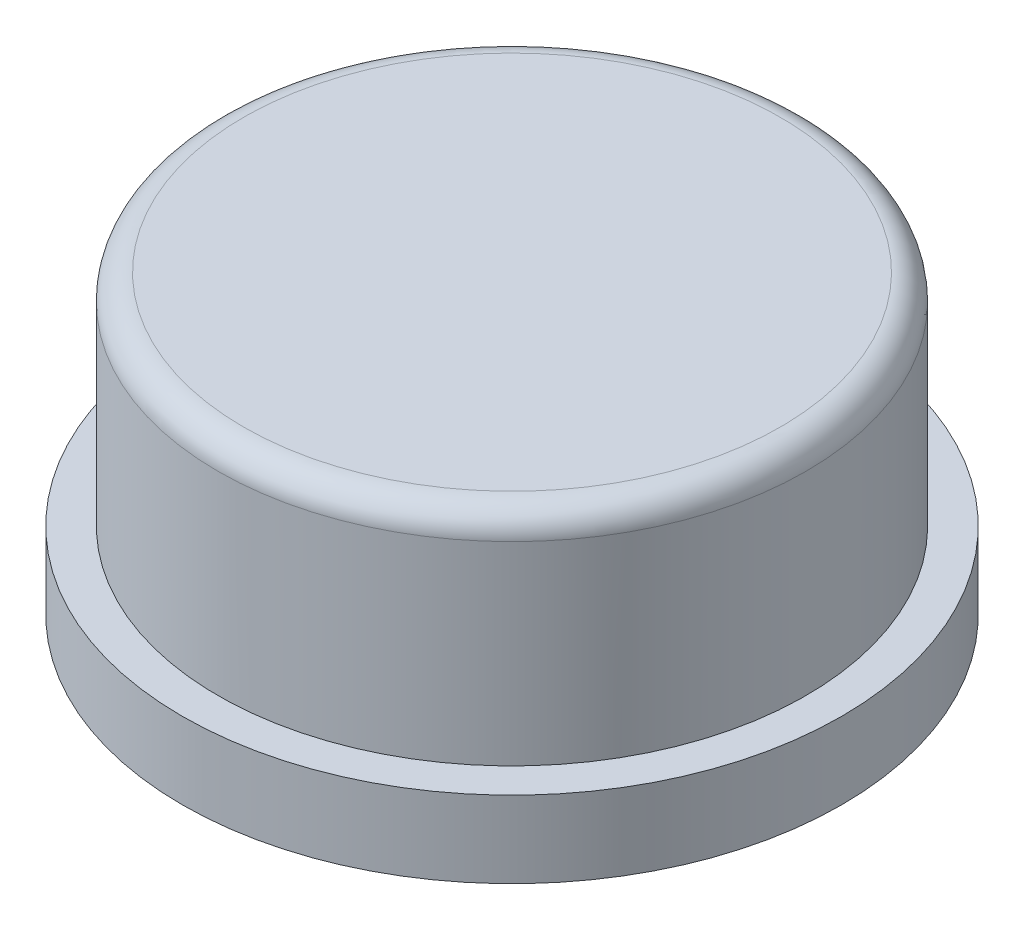
from build123d import *

# Parameters (mm, degrees)
SKETCH1_R           = 6.45
BOSS_EXTRUDE1_DEPTH = 1.5
SKETCH2_R           = 5.75
BOSS_EXTRUDE2_DEPTH = 4.3
FILLET1_R           = 0.5


with BuildPart() as part:
    # Sketch1 → Boss-Extrude1 (new body)
    with BuildSketch(Plane(origin=(0, 0, 0), x_dir=(1, 0, 0), z_dir=(0, 1, 0))):
        with Locations(Location((0, 0, 0), (0, 0, 270))):
            Circle(SKETCH1_R)
    extrude(amount=BOSS_EXTRUDE1_DEPTH)

    # Sketch2 → Boss-Extrude2 (add)
    with BuildSketch(Plane(origin=(0, 1.5, 0), x_dir=(1, 0, 0), z_dir=(0, 1, 0))):
        with Locations(Location((0, 0, 0), (0, 0, 90))):
            Circle(SKETCH2_R)
    extrude(amount=BOSS_EXTRUDE2_DEPTH)

    # Fillet1
    fillet1_edges = [part.edges().sort_by_distance(p)[0] for p in [
        (0, 5.8, 5.75),
    ]]
    fillet(fillet1_edges, radius=FILLET1_R)


solid = part.part
